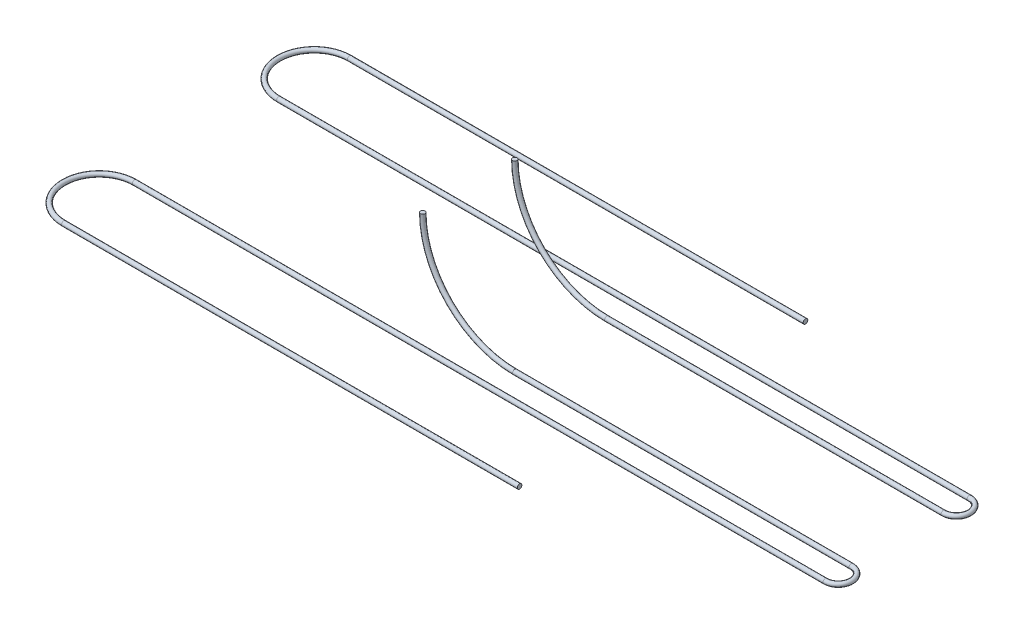
from build123d import *

# Parameters (mm, degrees)
SKETCH4_R = 0.5


with BuildPart() as part:
    # Sweep1: sweep along a curve in space
    with BuildLine() as sweep1_path:
        Line((22.09, 0, -31.05), (-76.91, 0, -31.05))
        ThreePointArc((-76.91, 0, -31.05), (-84.61, 0, -23.35), (-76.91, 0, -15.65))
        Line((-76.91, 0, -15.65), (73.09, 0, -15.65))
        ThreePointArc((73.09, 0, -15.65), (75.915, 0, -12.825), (73.09, 0, -10))
        Line((73.09, 0, -10), (0, 0, -10))
        ThreePointArc((0, 0, -10), (-14.142135624, 5.857864376, -10), (-20, 20, -10))
    # Sketch4 → Sweep1 (sweep)
    with BuildSketch(Plane(origin=(22.09, 0, 0), x_dir=(0, 0, -1), z_dir=(1, 0, 0))):
        with Locations((31.05, 0)):
            Circle(SKETCH4_R)
    sweep(path=sweep1_path.line)


with BuildPart() as body_2:
    # Mirror2: mirrored copy
    add(part.part.mirror(Plane.XY))


solid = Compound([part.part, body_2.part])
